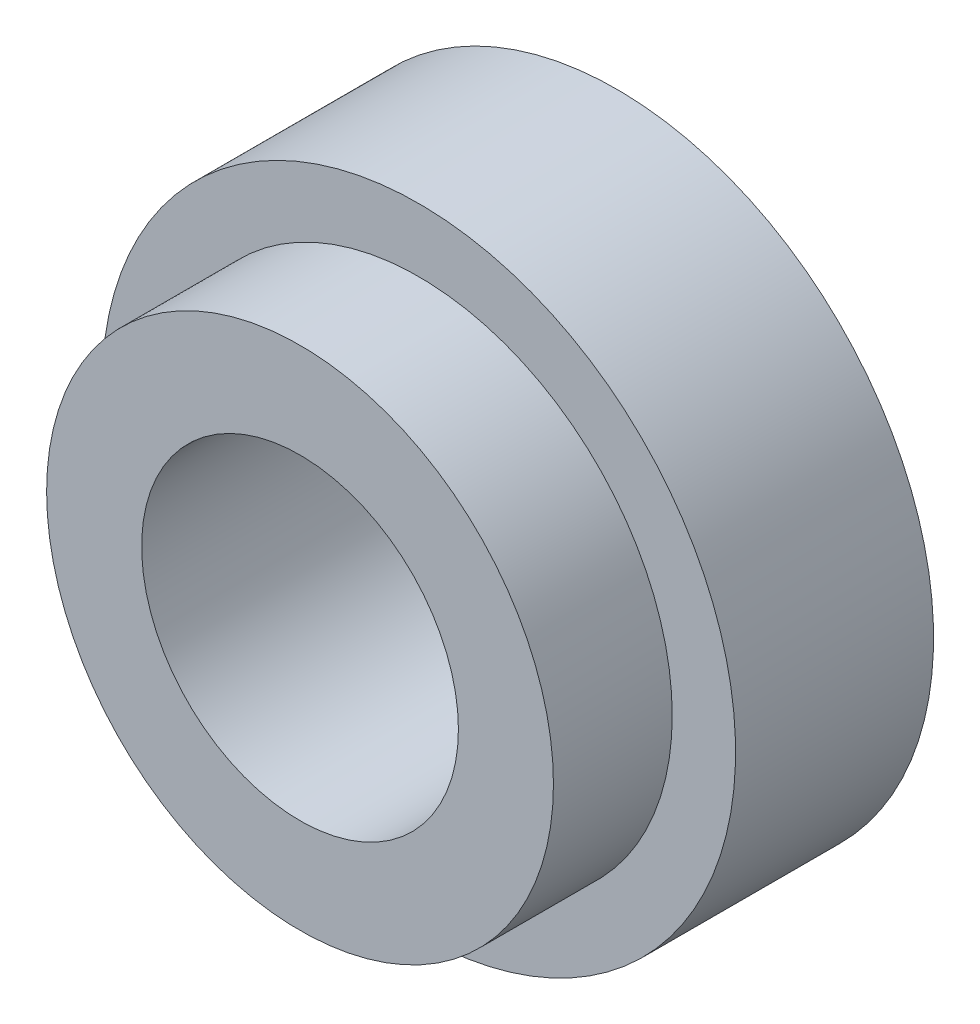
from build123d import *

# Parameters (mm, degrees)
SKETCH1_R          = 6.4
EXTRUDE1_DEPTH     = 3
SKETCH2_R          = 8
EXTRUDE2_DEPTH     = 5
SKETCH3_R          = 4
CUT_EXTRUDE1_DEPTH = 33.062439084


with BuildPart() as part:
    # Sketch1 → Extrude1 (new body)
    with BuildSketch(Plane.XY):
        with Locations((0, -22)):
            Circle(SKETCH1_R)
    extrude(amount=-EXTRUDE1_DEPTH)

    # Sketch2 → Extrude2 (add)
    with BuildSketch(Plane(origin=(0, 0, -3), x_dir=(-1, 0, 0), z_dir=(0, 0, -1))):
        with Locations((0, -22)):
            Circle(SKETCH2_R)
    extrude(amount=EXTRUDE2_DEPTH)

    # Sketch3 → Cut-Extrude1 (cut, through all)
    with BuildSketch(Plane.XY):
        with Locations((0, -22)):
            Circle(SKETCH3_R)
    extrude(amount=-CUT_EXTRUDE1_DEPTH, mode=Mode.SUBTRACT)


solid = part.part
